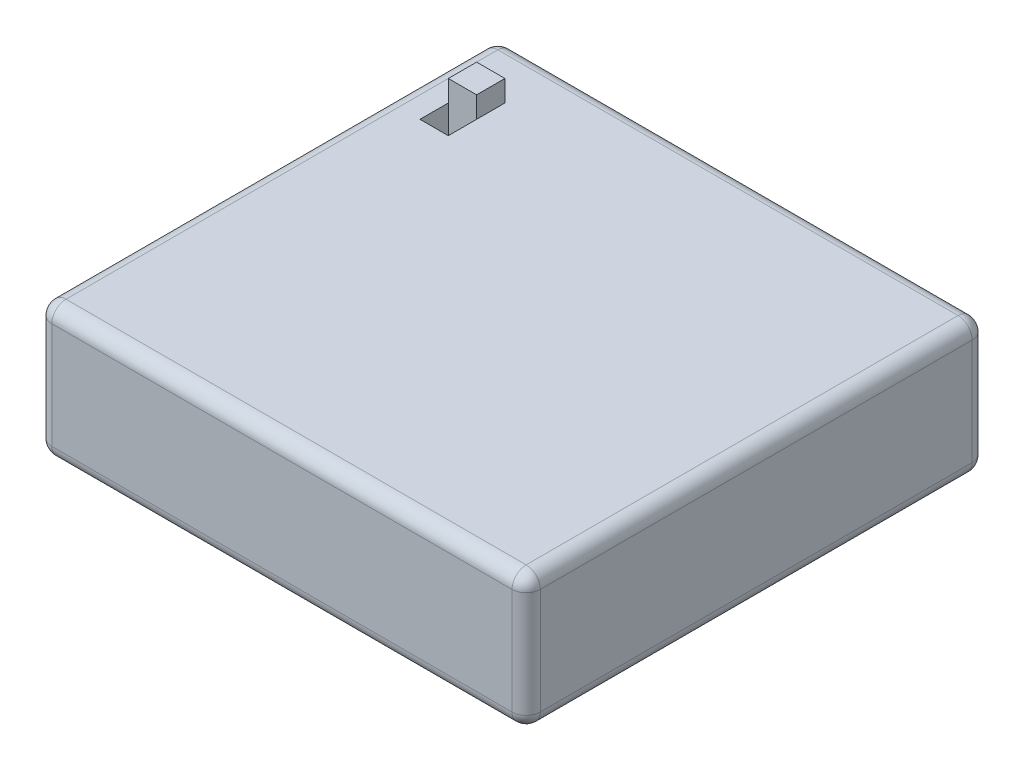
from build123d import *

# Parameters (mm, degrees)
EXTRUDE_1_DEPTH     = 65
FILLET_1_R          = 2
SKETCH_2_W          = 4
SKETCH_2_H          = 8
CUT_EXTRUDE_1_DEPTH = 4
SKETCH_4_W          = 4
SKETCH_4_H          = 4
EXTRUDE_2_DEPTH     = 7
SKETCH_5_R          = 0.5
EXTRUDE_3_DEPTH     = 5


with BuildPart() as part:
    # Эскиз1 → Бобышка-Вытянуть1 (new body)
    with BuildSketch(Plane.XY):
        with BuildLine():
            Line((32.5, -9.5), (-32.5, -9.5))
            ThreePointArc((-32.5, -9.5), (-33.914213562, -8.914213562), (-34.5, -7.5))
            Line((-34.5, -7.5), (-34.5, 7.5))
            ThreePointArc((-34.5, 7.5), (-33.914213562, 8.914213562), (-32.5, 9.5))
            Line((-32.5, 9.5), (32.5, 9.5))
            ThreePointArc((32.5, 9.5), (33.914213562, 8.914213562), (34.5, 7.5))
            Line((34.5, 7.5), (34.5, -7.5))
            ThreePointArc((34.5, -7.5), (33.914213562, -8.914213562), (32.5, -9.5))
        make_face()
    extrude(amount=EXTRUDE_1_DEPTH)

    # Скругление1
    fillet_1_edges = [part.edges().sort_by_distance(p)[0] for p in [
        (-33.914213562, -8.914213562, 65),
        (-34.5, 0, 0),
        (-33.914213562, 8.914213562, 0),
        (0, -9.5, 65),
        (33.914213562, -8.914213562, 65),
        (34.5, 0, 65),
        (33.914213562, 8.914213562, 65),
        (0, 9.5, 65),
        (-33.914213562, 8.914213562, 65),
        (-34.5, 0, 65),
        (0, 9.5, 0),
        (33.914213562, 8.914213562, 0),
        (34.5, 0, 0),
        (33.914213562, -8.914213562, 0),
        (0, -9.5, 0),
        (-33.914213562, -8.914213562, 0),
    ]]
    fillet(fillet_1_edges, radius=FILLET_1_R)

    # Эскиз2 → Вырез-Вытянуть1 (cut)
    with BuildSketch(Plane(origin=(0, 9.5, 0), x_dir=(1, 0, 0), z_dir=(0, 1, 0))):
        with Locations((-27.5, -12)):
            Rectangle(SKETCH_2_W, SKETCH_2_H)
    extrude(amount=-CUT_EXTRUDE_1_DEPTH, mode=Mode.SUBTRACT)

    # Эскиз4 → Бобышка-Вытянуть2 (add)
    with BuildSketch(Plane(origin=(0, 5.5, 0), x_dir=(1, 0, 0), z_dir=(0, 1, 0))):
        with Locations((-27.5, -10)):
            Rectangle(SKETCH_4_W, SKETCH_4_H)
    extrude(amount=EXTRUDE_2_DEPTH)

    # Эскиз5 → Бобышка-Вытянуть3 (add)
    with BuildSketch(Plane.ZY.offset(34.5)):
        with Locations(Location((55, 0, 0), (0, 0, 180))):
            Circle(SKETCH_5_R)
        with Locations(Location((57, 0, 0), (0, 0, 180))):
            Circle(SKETCH_5_R)
    extrude(amount=EXTRUDE_3_DEPTH)


solid = part.part
